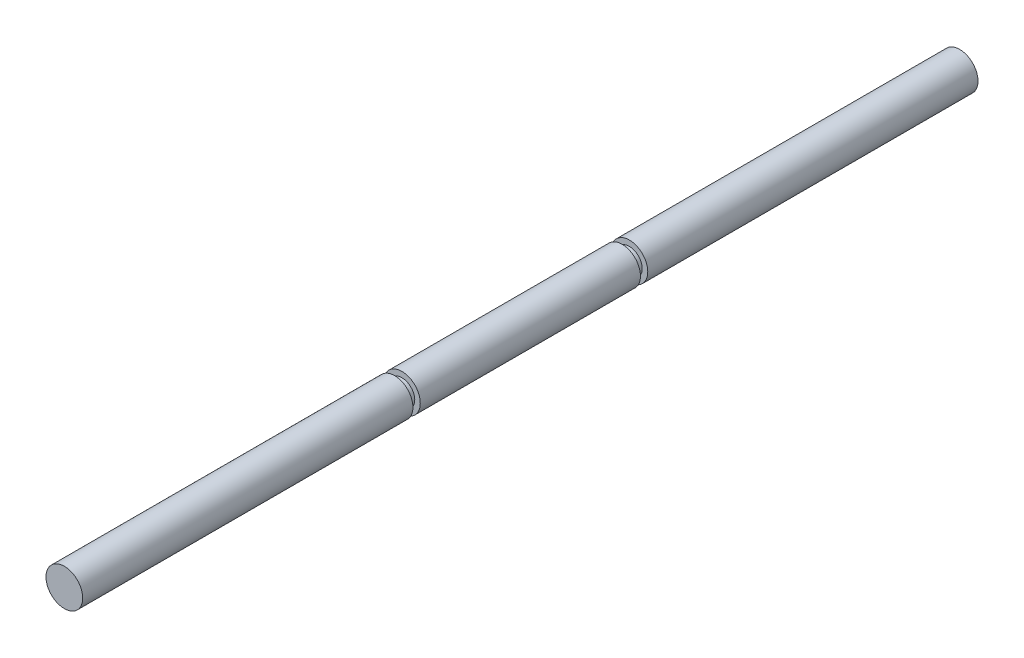
from build123d import *

# Parameters (mm, degrees)
SKETCH_1_R      = 5
EXTRUDE_1_DEPTH = 60
SKETCH_2_R      = 3.5
EXTRUDE_2_DEPTH = 2
EXTRUDE_START   = 2
SKETCH_3_R      = 3.5
EXTRUDE_3_DEPTH = 2
EXTRUDE_START_2 = 90
SKETCH_4_R      = 5
EXTRUDE_4_DEPTH = 90
SKETCH_5_R      = 5
EXTRUDE_5_DEPTH = 90


with BuildPart() as part:
    # 草图1 → 凸台-拉伸1 (new body)
    with BuildSketch(Plane.XY):
        Circle(SKETCH_1_R)
    extrude(amount=EXTRUDE_1_DEPTH)

    # 草图2 → 凸台-拉伸2 (add)
    with BuildSketch(Plane.XY.offset(60)):
        Circle(SKETCH_2_R)
    extrude(amount=EXTRUDE_2_DEPTH)

    # 草图3 → 凸台-拉伸3 (add)
    with BuildSketch(Plane(origin=(0, 0, 0), x_dir=(-1, 0, 0), z_dir=(0, 0, -1)).offset(EXTRUDE_START)):
        with Locations(Location((0, 0, 0), (0, 0, 180))):
            Circle(SKETCH_3_R)
    extrude(amount=-EXTRUDE_3_DEPTH)

    # 草图4 → 凸台-拉伸4 (add)
    with BuildSketch(Plane(origin=(0, 0, -2), x_dir=(-1, 0, 0), z_dir=(0, 0, -1)).offset(EXTRUDE_START_2)):
        with Locations(Location((0, 0, 0), (0, 0, 180))):
            Circle(SKETCH_4_R)
    extrude(amount=-EXTRUDE_4_DEPTH)

    # 草图5 → 凸台-拉伸5 (add)
    with BuildSketch(Plane.XY.offset(62)):
        Circle(SKETCH_5_R)
    extrude(amount=EXTRUDE_5_DEPTH)


solid = part.part
